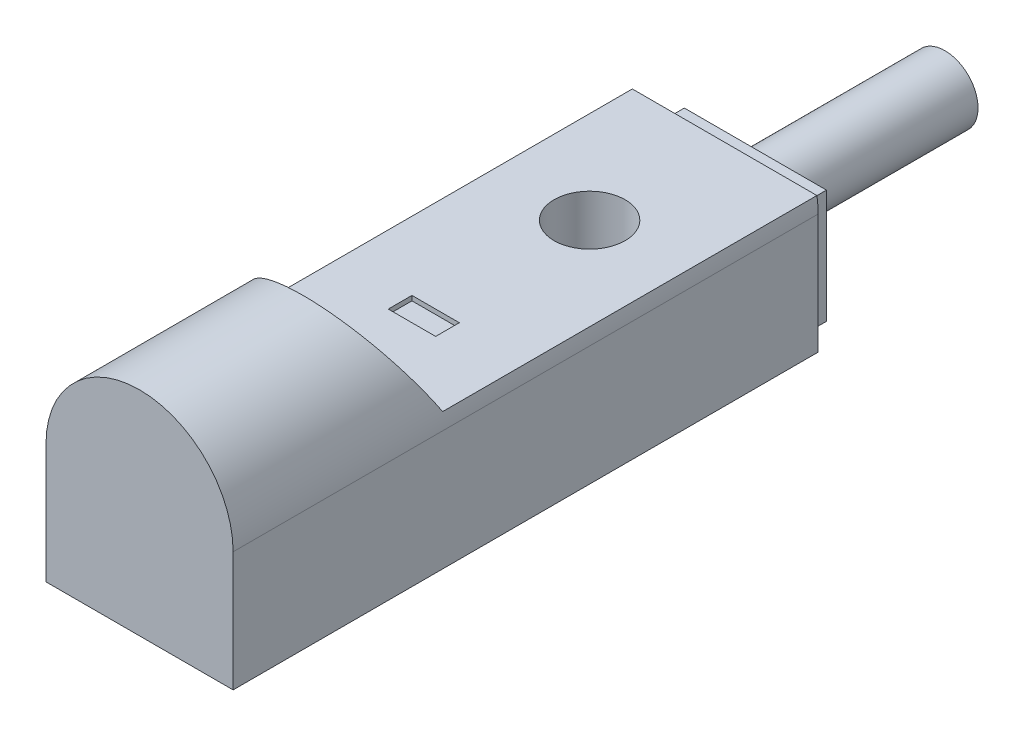
from build123d import *

# Parameters (mm, degrees)
BOSS_EXTRU_1_DEPTH           = 24.7
ENL_V_MAT_EXTRU_1_DEPTH      = 27.583688608
ENL_V_MAT_EXTRU_1_DEPTH_BACK = 27.583688608
D_GAGEMENT_M31_D             = 3
ESQUISSE5_W                  = 6
ESQUISSE5_H                  = 4.8
BOSS_EXTRU_2_DEPTH           = 1.3
ESQUISSE6_R                  = 1.4
BOSS_EXTRU_3_DEPTH           = 8
ESQUISSE7_W                  = 2
ESQUISSE7_H                  = 1
ENL_V_MAT_EXTRU_2_DEPTH      = 0.2


with BuildPart() as part:
    # Esquisse1 → Boss.-Extru.1 (new body)
    with BuildSketch(Plane.XY):
        with BuildLine():
            Line((-3.95, 5.05), (-3.95, 0))
            Line((-3.95, 0), (3.95, 0))
            Line((3.95, 0), (3.95, 5.05))
            ThreePointArc((3.95, 5.05), (0, 9), (-3.95, 5.05))
        make_face()
    extrude(amount=-BOSS_EXTRU_1_DEPTH)

    # Esquisse2 → Enlèv. mat.-Extru.1 (cut, two sides: drawn at the far end of the back side and taken through both)
    with BuildSketch(Plane(origin=(0, 0, 0), x_dir=(0, 0, -1), z_dir=(1, 0, 0)).offset(-ENL_V_MAT_EXTRU_1_DEPTH_BACK)):
        Polygon((6.9, 9), (8.9, 5.7), (24.7, 5.7), (24.7, 9), align=None)
    extrude(amount=ENL_V_MAT_EXTRU_1_DEPTH + ENL_V_MAT_EXTRU_1_DEPTH_BACK, mode=Mode.SUBTRACT)

    # Dégagement M31 (through all)
    with Locations(Plane(origin=(0, 5.7, 0), x_dir=(1, 0, 0), z_dir=(0, 1, 0))):
        with Locations((0, 19)):
            Hole(D_GAGEMENT_M31_D / 2)

    # Esquisse5 → Boss.-Extru.2 (add)
    with BuildSketch(Plane(origin=(0, 0, -24.7), x_dir=(-1, 0, 0), z_dir=(0, 0, -1))):
        with Locations((0, 2.4)):
            Rectangle(ESQUISSE5_W, ESQUISSE5_H)
    extrude(amount=BOSS_EXTRU_2_DEPTH)

    # Esquisse6 → Boss.-Extru.3 (add)
    with BuildSketch(Plane(origin=(0, 0, -26), x_dir=(-1, 0, 0), z_dir=(0, 0, -1))):
        with Locations((0, 3)):
            Circle(ESQUISSE6_R)
    extrude(amount=BOSS_EXTRU_3_DEPTH)

    # Esquisse7 → Enlèv. mat.-Extru.2 (cut)
    with BuildSketch(Plane(origin=(0, 5.7, 0), x_dir=(1, 0, 0), z_dir=(0, 1, 0))):
        with Locations((0, 12)):
            Rectangle(ESQUISSE7_W, ESQUISSE7_H)
    extrude(amount=-ENL_V_MAT_EXTRU_2_DEPTH, mode=Mode.SUBTRACT)


solid = part.part
